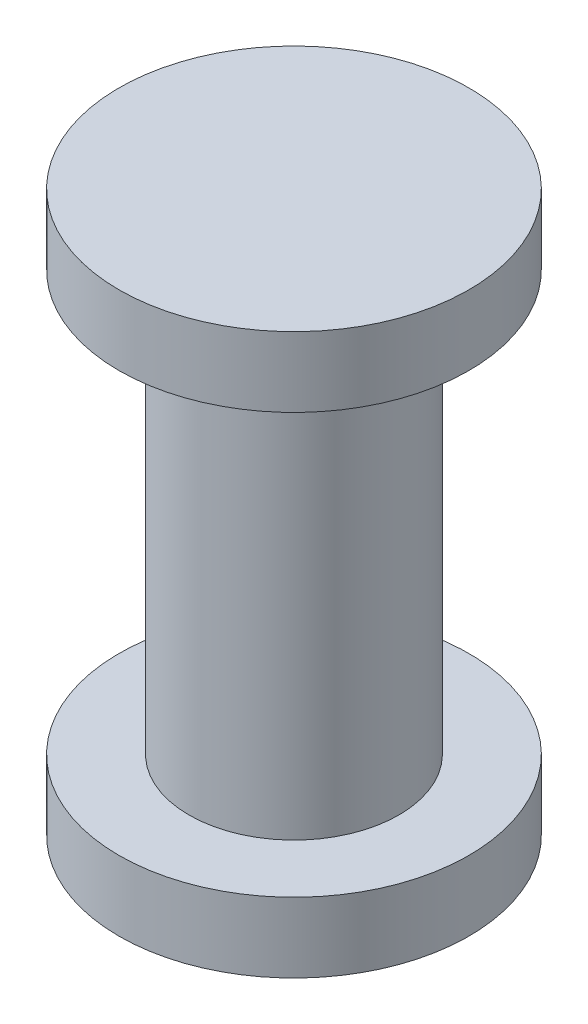
from build123d import *


with BuildPart() as part:
    # Sketch1 → Revolve1 (revolve)
    with BuildSketch(Plane.XY, mode=Mode.PRIVATE) as revolve1_sk:
        Polygon((-14.761543591, 27.948638362), (-17.261543591, 27.948638362), (-17.261543591, 26.948638362), (-16.261543591, 26.948638362), (-16.261543591, 20.948638362), (-17.261543591, 20.948638362), (-17.261543591, 19.948638362), (-14.761543591, 19.948638362), align=None)
    revolve(revolve1_sk.sketch.rotate(Axis((-14.761543591, 27.948638362, 0), (0, -1, 0)), 270), axis=Axis((-14.761543591, 27.948638362, 0), (0, -1, 0)))


solid = part.part
